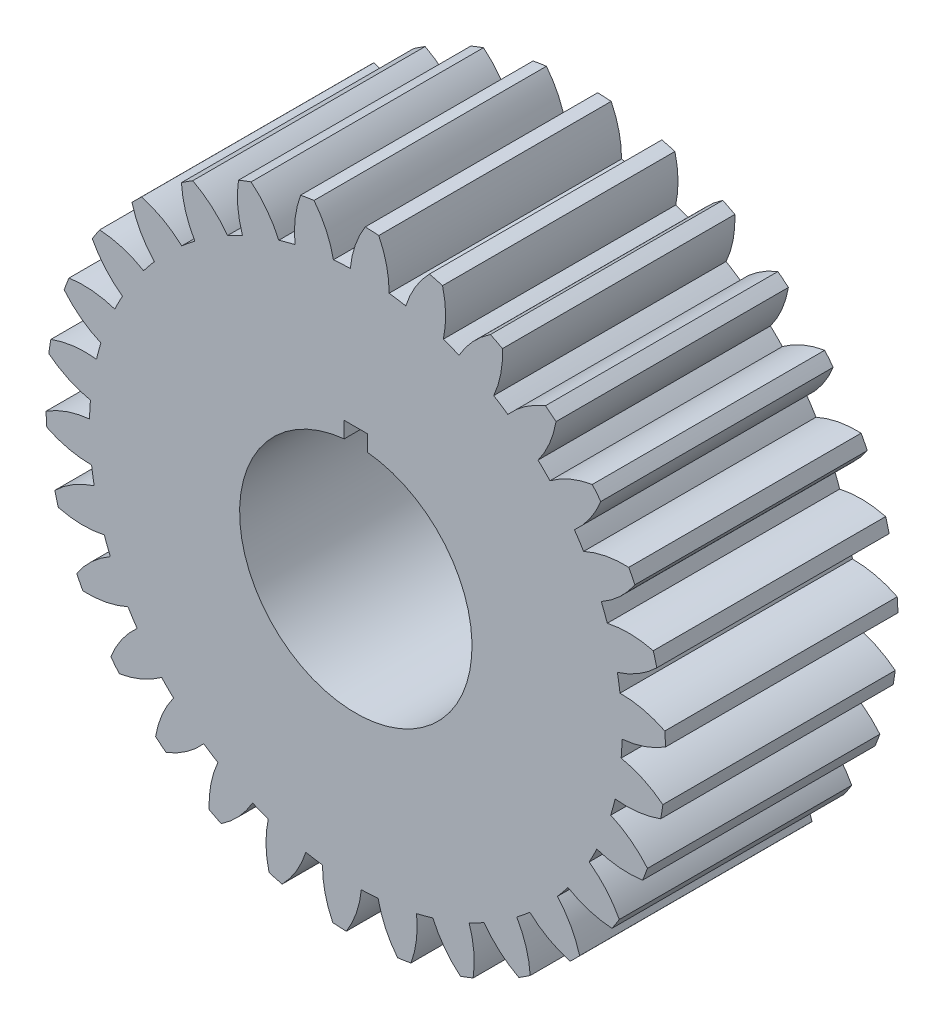
from build123d import *

# Parameters (mm, degrees)
SKETCH_1_R               = 34.375
EXTRUDE_1_DEPTH          = 30
EXTRUDE_START            = -30
EXTRUDE_2_DEPTH          = 30
PATTERN_CIRCULAR_1_COUNT = 30
CUT_EXTRUDE_1_DEPTH      = 30


with BuildPart() as part:
    # 草图1 → 凸台-拉伸1 (new body)
    with BuildSketch(Plane.XY):
        Circle(SKETCH_1_R)
    extrude(amount=EXTRUDE_1_DEPTH)

    # 草图2 → 凸台-拉伸2 (add)
    with BuildSketch(Plane.XY.offset(30).offset(EXTRUDE_START)):
        with BuildLine():
            ThreePointArc((2.965504601, 39.889920813), (2.09343825, 39.94518139), (1.220372866, 39.981379292))
            ThreePointArc((1.220372866, 39.981379292), (-0.075113847, 37.287853424), (-0.712008739, 34.367625297))
            ThreePointArc((-0.712008739, 34.367625297), (1.799048496, 34.327890257), (4.300503339, 34.10493067))
            ThreePointArc((4.300503339, 34.10493067), (3.972344382, 37.075735127), (2.965504601, 39.889920813))
        make_face()
    extrude_2 = extrude(amount=EXTRUDE_2_DEPTH)

    # 阵列(圆周)1: 凸台-拉伸2 ×30 about axis
    pattern_circular_1_axis = Axis((0, 0, 0), (0, 0, 1))
    for i in range(1, PATTERN_CIRCULAR_1_COUNT):
        add(extrude_2.rotate(pattern_circular_1_axis, i * 360 / PATTERN_CIRCULAR_1_COUNT))

    # 草图3 → 切除-拉伸1 (cut)
    with BuildSketch(Plane.XY.offset(30)):
        with BuildLine():
            Line((-1.5, 14.924811557), (-1.5, 0))
            Line((-1.5, 0), (1.5, 0))
            Line((1.5, 0), (1.5, 14.924811557))
            ThreePointArc((1.5, 14.924811557), (0, 15), (-1.5, 14.924811557))
        make_face()
        with BuildLine():
            Line((1.5, 0), (-1.5, 0))
            Line((-1.5, 0), (-1.5, 14.924811557))
            ThreePointArc((-1.5, 14.924811557), (-10.062305899, -11.124297731), (15, 0))
            ThreePointArc((15, 0), (11.124297731, 10.062305899), (1.5, 14.924811557))
            Line((1.5, 14.924811557), (1.5, 0))
        make_face()
        with BuildLine():
            Line((-1.5, 17), (-1.5, 14.924811557))
            ThreePointArc((-1.5, 14.924811557), (0, 15), (1.5, 14.924811557))
            Line((1.5, 14.924811557), (1.5, 17))
            Line((1.5, 17), (-1.5, 17))
        make_face()
    extrude(amount=-CUT_EXTRUDE_1_DEPTH, mode=Mode.SUBTRACT)


solid = part.part
